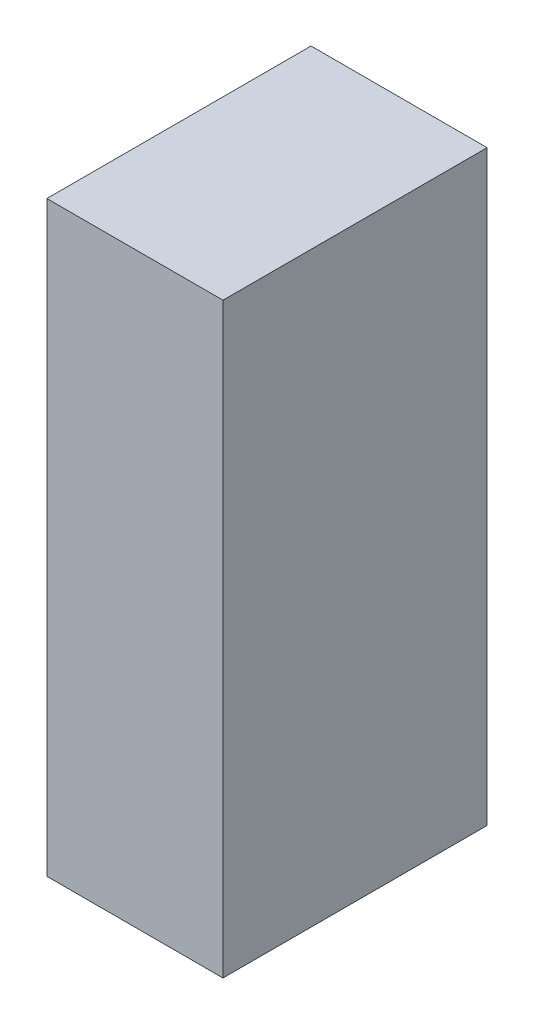
from build123d import *

# Parameters (mm, degrees)
SKETCH1_W           = 24000
SKETCH1_H           = 80000
BOSS_EXTRUDE1_DEPTH = 36000


with BuildPart() as part:
    # Sketch1 → Boss-Extrude1 (new body)
    with BuildSketch(Plane.XY):
        with Locations((14234.817813765, 40000)):
            Rectangle(SKETCH1_W, SKETCH1_H)
    extrude(amount=BOSS_EXTRUDE1_DEPTH)


solid = part.part
